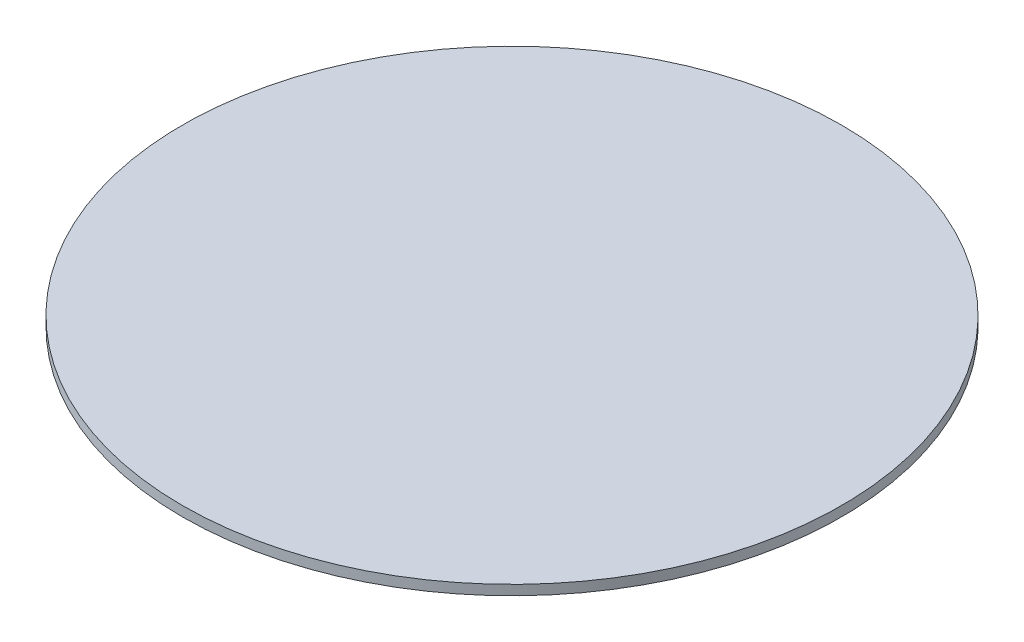
from build123d import *

# Parameters (mm, degrees)
SKETCH1_R = 20
PCB_DEPTH = 0.6


with BuildPart() as part:
    # Sketch1 → PCB (new body)
    with BuildSketch(Plane(origin=(0, 0, 0), x_dir=(1, 0, 0), z_dir=(0, 1, 0))):
        with Locations(Location((0, 0, 0), (0, 0, 270))):
            Circle(SKETCH1_R)
    extrude(amount=PCB_DEPTH)


solid = part.part
